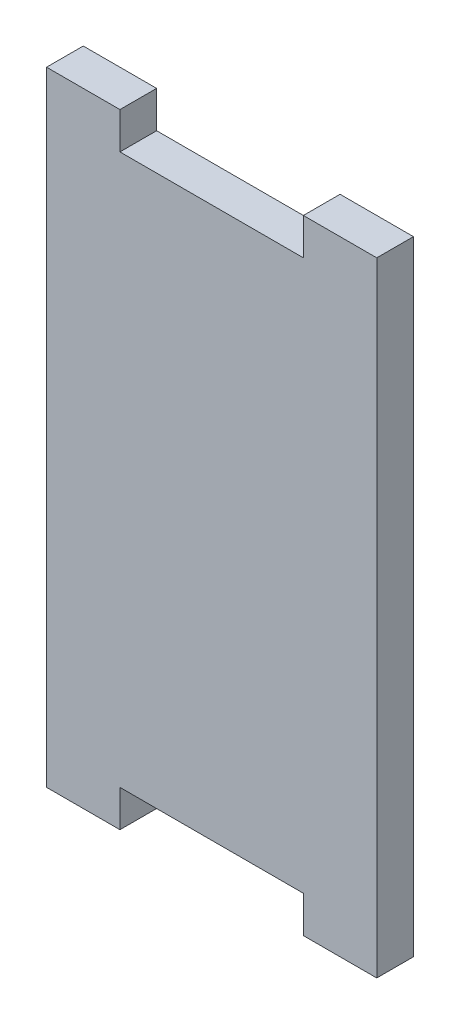
from build123d import *

# Parameters (mm, degrees)
ESQUISSE1_W        = 45
ESQUISSE1_H        = 75
BOSS_EXTRU_1_DEPTH = 5
ESQUISSE2_W        = 10
ESQUISSE2_H        = 5
BOSS_EXTRU_2_DEPTH = 5


with BuildPart() as part:
    # Esquisse1 → Boss.-Extru.1 (new body)
    with BuildSketch(Plane.XY):
        with Locations((22.5, 37.5)):
            Rectangle(ESQUISSE1_W, ESQUISSE1_H)
    extrude(amount=BOSS_EXTRU_1_DEPTH)

    # Esquisse2 → Boss.-Extru.2 (add)
    with BuildSketch(Plane.XY.offset(5)):
        with Locations((5, 77.5)):
            Rectangle(ESQUISSE2_W, ESQUISSE2_H)
        with Locations((40, 77.5)):
            Rectangle(ESQUISSE2_W, ESQUISSE2_H)
        with Locations((5, -2.5)):
            Rectangle(ESQUISSE2_W, ESQUISSE2_H)
        with Locations((40, -2.5)):
            Rectangle(ESQUISSE2_W, ESQUISSE2_H)
    extrude(amount=-BOSS_EXTRU_2_DEPTH)


solid = part.part
